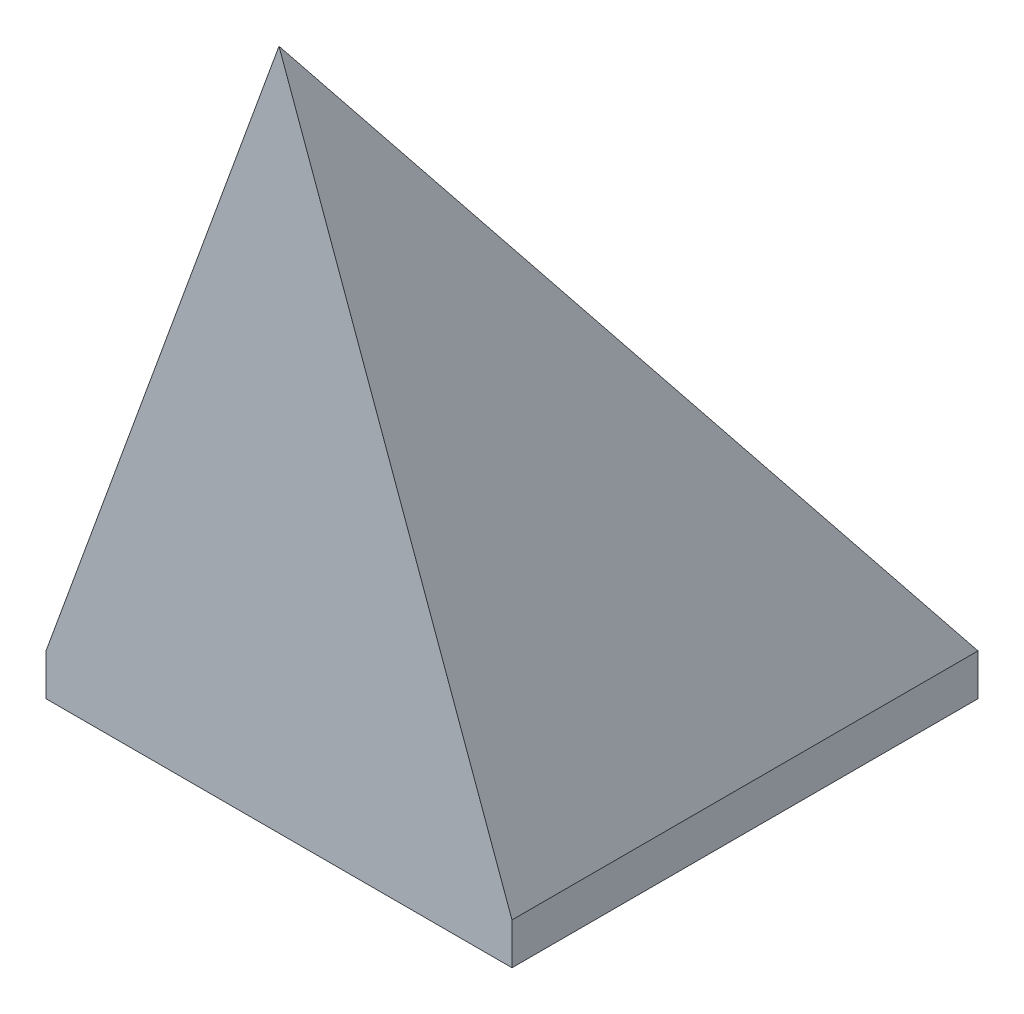
from build123d import *

# Parameters (mm, degrees)
SKETCH_1_W          = 45
SKETCH_1_H          = 45
SKETCH_1_R          = 1.7
EXTRUDE_1_DEPTH     = 4
EXTRUDE_2_DEPTH     = 5
EXTRUDE_3_DEPTH     = 65.785596942
EXTRUDE_4_DEPTH     = 65.785596942
CUT_EXTRUDE_1_DEPTH = 92.553486945
CUT_EXTRUDE_2_DEPTH = 85.512691631
EXTRUDE_9_REACH     = 86.713
CHAMFER_1_SIZE      = 5
EXTRUDE_10_REACH    = 86.713
EXTRUDE_11_REACH    = 88.671
SKETCH_13_W         = 5
SKETCH_13_H         = 28.755225939


with BuildPart() as part:
    # 草图1 → 凸台-拉伸1 (new body)
    with BuildSketch(Plane(origin=(0, 0, 0), x_dir=(1, 0, 0), z_dir=(0, 1, 0))):
        with Locations((22.5, 22.5)):
            Rectangle(SKETCH_1_W, SKETCH_1_H)
        with Locations(Location((15, 30, 0), (0, 0, 270))):
            Circle(SKETCH_1_R, mode=Mode.SUBTRACT)
        with Locations(Location((30, 30, 0), (0, 0, 270))):
            Circle(SKETCH_1_R, mode=Mode.SUBTRACT)
        with Locations(Location((15, 15, 0), (0, 0, 270))):
            Circle(SKETCH_1_R, mode=Mode.SUBTRACT)
        with Locations(Location((30, 15, 0), (0, 0, 270))):
            Circle(SKETCH_1_R, mode=Mode.SUBTRACT)
    extrude(amount=EXTRUDE_1_DEPTH)

    # 草图2 → 凸台-拉伸2 (add)
    with BuildSketch(Plane.XY):
        Polygon((0, 4), (22.5, 65.818241938), (45, 4), align=None)
    extrude(amount=-EXTRUDE_2_DEPTH)

    # 草图3 → 凸台-拉伸3 (add, along a direction that is not the sketch's normal)
    with BuildSketch(Plane(origin=(0, 4, 0), x_dir=(1, 0, 0), z_dir=(0, 1, 0))):
        Polygon((0, 5), (0, 45), (4, 45), (7, 5), align=None)
    extrude(amount=EXTRUDE_3_DEPTH, dir=(0.34202014332566566, 0.9396926207859095, 0))

    # 草图4 → 凸台-拉伸4 (add, along a direction that is not the sketch's normal)
    with BuildSketch(Plane(origin=(0, 4, 0), x_dir=(1, 0, 0), z_dir=(0, 1, 0))):
        Polygon((45, 45), (41, 45), (38, 5), (45, 5), align=None)
    extrude(amount=EXTRUDE_4_DEPTH, dir=(-0.3420201433256661, 0.9396926207859094, 0))

    # 草图5 → 切除-拉伸1 (cut, through all)
    with BuildSketch(Plane.XY):
        Polygon((22.5, 65.818241938), (19, 56.20207097), (11, 56.20207097), (11, 66.20207097), (34, 66.20207097), (34, 56.20207097), (26, 56.20207097), align=None)
    extrude(amount=-CUT_EXTRUDE_1_DEPTH, mode=Mode.SUBTRACT)

    # 草图6 → 切除-拉伸2 (cut, through all, along a direction that is not the sketch's normal)
    with BuildSketch(Plane(origin=(41.02157519, 14.930632332, 0), x_dir=(0, 0, -1), z_dir=(0.9396926207859093, 0.3420201433256662, 0))):
        Polygon((0, 54.153463037), (45, -11.632135967), (45, 54.153463037), align=None)
    extrude(amount=-CUT_EXTRUDE_2_DEPTH, dir=(1, 0, 0), mode=Mode.SUBTRACT)

    # 凸台-拉伸9: up to this plane
    extrude_9_end = Plane(origin=(26.5, 65.818241938, -45), z_dir=(-0.9373675520499937, 0.34117388751316935, 0.07030256640374952))
    # 草图8 → 凸台-拉伸9 (add, up to the surface)
    with BuildSketch(Plane(origin=(34.338725854, 12.498274094, 2.575404439), x_dir=(-0.06606280287191471, -0.024044893837572568, 0.9975257135317598), z_dir=(-0.9373675520499937, -0.34117388751316985, -0.07030256640374943)), mode=Mode.PRIVATE) as extrude_9_sk1:
        Polygon((-47.693411602, -10.264055393), (-46.016852855, -7.776255006), (-42.693411602, -10.136115185), align=None)
    extrude_9_tool1 = split(extrude(extrude_9_sk1.sketch, amount=EXTRUDE_9_REACH, dir=(-1, 0, 0), mode=Mode.PRIVATE), bisect_by=extrude_9_end, keep=Keep.BOTH, mode=Mode.PRIVATE)
    add(extrude_9_tool1.solids().sort_by_distance((40.554764, 4.765818, -42.779987))[0])

    # 倒角1
    chamfer_1_edges = [part.edges().sort_by_distance(p)[0] for p in [
        (22.5, 4, -5),
    ]]
    chamfer(chamfer_1_edges, length=CHAMFER_1_SIZE)

    # 凸台-拉伸10: up to this plane
    extrude_10_end = Plane(origin=(26.5, 65.818241938, -45), z_dir=(-0.9373675520499937, 0.34117388751316935, 0.07030256640374952))
    # 草图10 → 凸台-拉伸10 (add, up to the surface)
    with BuildSketch(Plane(origin=(34.338725854, 12.498274094, 2.575404439), x_dir=(-0.06606280287191474, -0.024044893837572537, 0.9975257135317598), z_dir=(-0.9373675520499936, -0.34117388751316985, -0.07030256640374943)), mode=Mode.PRIVATE) as extrude_10_sk1:
        Polygon((-27.358712809, 19.91005667), (-30.728273238, 14.91005667), (-7.594194652, 14.91005667), (-7.594194652, 19.91005667), align=None)
    extrude_10_tool1 = split(extrude(extrude_10_sk1.sketch, amount=EXTRUDE_10_REACH, dir=(-1, 0, 0), mode=Mode.PRIVATE), bisect_by=extrude_10_end, keep=Keep.BOTH, mode=Mode.PRIVATE)
    add(extrude_10_tool1.solids().sort_by_distance((29.618174, 29.237872, -15.720115))[0])

    # 凸台-拉伸11: up to this plane
    extrude_11_end = Plane(origin=(0, 0, -5), z_dir=(0, 0, -1))
    # 草图13 → 凸台-拉伸11 (add, up to the surface)
    with BuildSketch(Plane(origin=(0, 22.796896106, -31.316978642), x_dir=(-1, 0, 0), z_dir=(0, 0.5885247359201023, -0.8084792113654956)), mode=Mode.PRIVATE) as extrude_11_sk1:
        with Locations((-22.5, -8.872083302)):
            Rectangle(SKETCH_13_W, SKETCH_13_H)
    extrude_11_tool1 = split(extrude(extrude_11_sk1.sketch, amount=EXTRUDE_11_REACH, dir=(0, 0, 1), mode=Mode.PRIVATE), bisect_by=extrude_11_end, keep=Keep.BOTH, mode=Mode.PRIVATE)
    add(extrude_11_tool1.solids().sort_by_distance((22.5, 15.624001, -36.538419))[0])


solid = part.part
